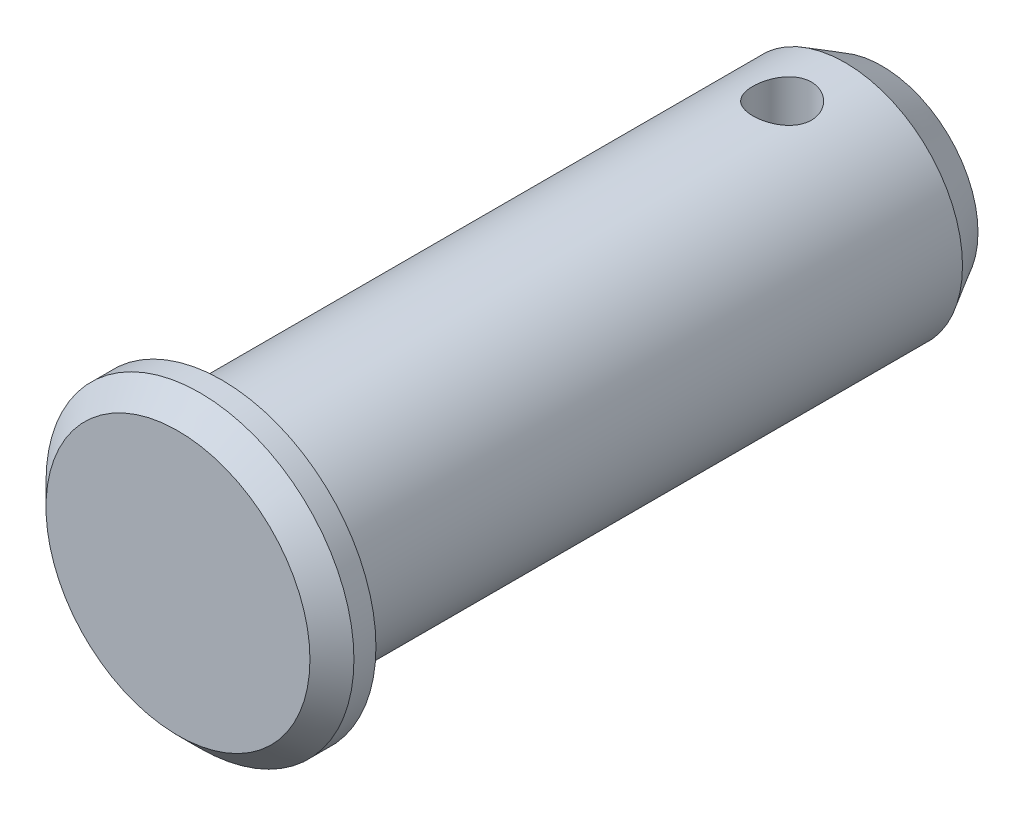
from build123d import *

# Parameters (mm, degrees)
WYTNIJ_WYCI_GNI_CIE1_DEPTH      = 29.222331583
WYTNIJ_WYCI_GNI_CIE1_DEPTH_BACK = 29.222331583
SZKIC2_R                        = 2


with BuildPart() as part:
    # Szkic1 → Obrót1 (revolve)
    with BuildSketch(Plane(origin=(0, 0, 0), x_dir=(1, 0, 0), z_dir=(0, 1, 0))):
        Polygon((0, -24), (9, -24), (10.5, -22.5), (10.5, -21), (8, -21), (8, 21.5), (6.556624327, 24), (0, 24), align=None)
    revolve(axis=Axis((0, 0, 24), (0, 0, -1)))

    # Szkic2 → Wytnij-wyciągnięcie1 (cut, two sides: drawn at the far end of the back side and taken through both)
    with BuildSketch(Plane(origin=(0, 0, 0), x_dir=(1, 0, 0), z_dir=(0, 1, 0)).offset(-WYTNIJ_WYCI_GNI_CIE1_DEPTH_BACK)):
        with Locations(Location((0, 17.2, 0), (0, 0, 270))):
            Circle(SZKIC2_R)
    extrude(amount=WYTNIJ_WYCI_GNI_CIE1_DEPTH + WYTNIJ_WYCI_GNI_CIE1_DEPTH_BACK, mode=Mode.SUBTRACT)


solid = part.part
